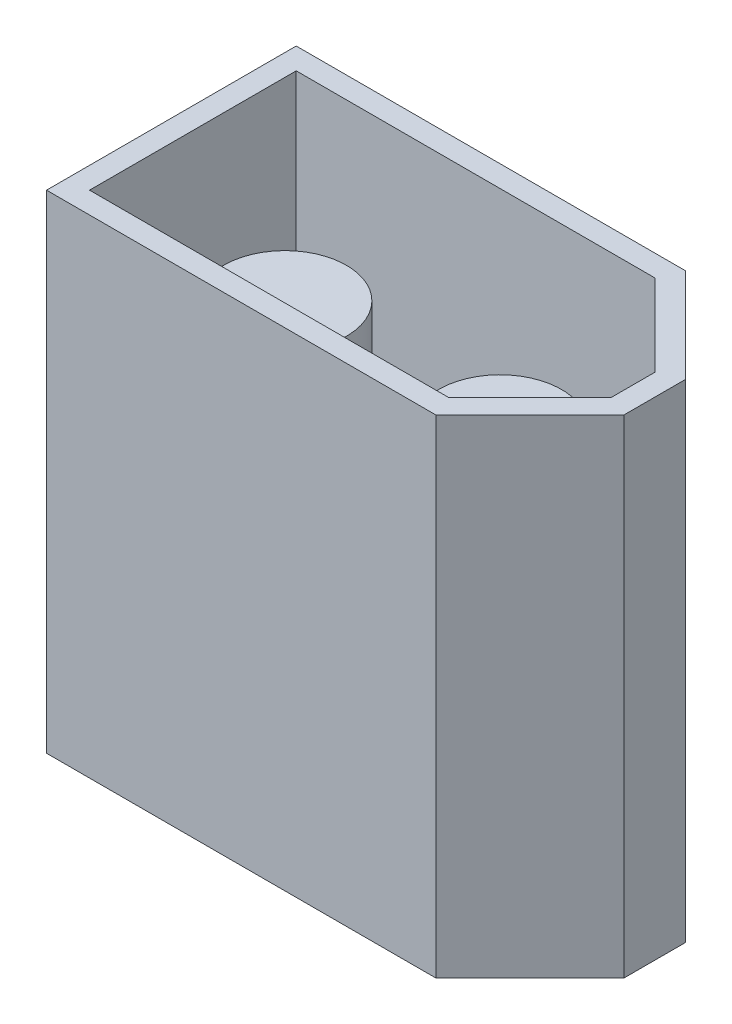
from build123d import *

# Parameters (mm, degrees)
P_IDAT_VYSUNUT_M1_DEPTH        = 15.875
SKO_EPINA1_T                   = -0.7
P_IDAT_VYSUNUT_M2_DEPTH        = 11.875
P_IDAT_VYSUNUT_M2_DEPTH_BACK   = 2
SKICA2_R                       = 2
P_IDAT_VYSUNUT_M2_2_DEPTH      = 11.875
P_IDAT_VYSUNUT_M2_2_DEPTH_BACK = 2


with BuildPart() as part:
    # Skica1 → Přidat vysunutím1 (new body)
    with BuildSketch(Plane(origin=(0, 0, 0), x_dir=(1, 0, 0), z_dir=(0, 1, 0))):
        Polygon((-7.86765, 4.064), (-7.86765, -4.064), (4.80365, -4.064), (7.86765, -1), (7.86765, 1), (4.80365, 4.064), align=None)
    extrude(amount=P_IDAT_VYSUNUT_M1_DEPTH)

    # Skořepina1
    sko_epina1_openings = [part.faces().sort_by_distance(p)[0] for p in [
        (-0.542357048, 15.875, 0),
    ]]
    offset(amount=SKO_EPINA1_T, openings=sko_epina1_openings, kind=Kind.INTERSECTION)


with BuildPart() as body_2:
    # Skica2 → Přidat vysunutím2 (new, two sides: drawn at the far end of the back side and taken through both)
    with BuildSketch(Plane(origin=(0, 0.7, 0), x_dir=(1, 0, 0), z_dir=(0, 1, 0)).offset(-P_IDAT_VYSUNUT_M2_DEPTH_BACK)):
        with Locations(Location((-4.16765, 0, 0), (0, 0, 270))):
            Circle(SKICA2_R)
    extrude(amount=P_IDAT_VYSUNUT_M2_DEPTH + P_IDAT_VYSUNUT_M2_DEPTH_BACK)


with BuildPart() as body_3:
    # Skica2 → P_idat vysunut_m2 2 (new, two sides: drawn at the far end of the back side and taken through both)
    with BuildSketch(Plane(origin=(0, 0.7, 0), x_dir=(1, 0, 0), z_dir=(0, 1, 0)).offset(-P_IDAT_VYSUNUT_M2_2_DEPTH_BACK)):
        with Locations(Location((2.83235, 0, 0), (0, 0, 270))):
            Circle(SKICA2_R)
    extrude(amount=P_IDAT_VYSUNUT_M2_2_DEPTH + P_IDAT_VYSUNUT_M2_2_DEPTH_BACK)


solid = Compound([part.part, body_2.part, body_3.part])
